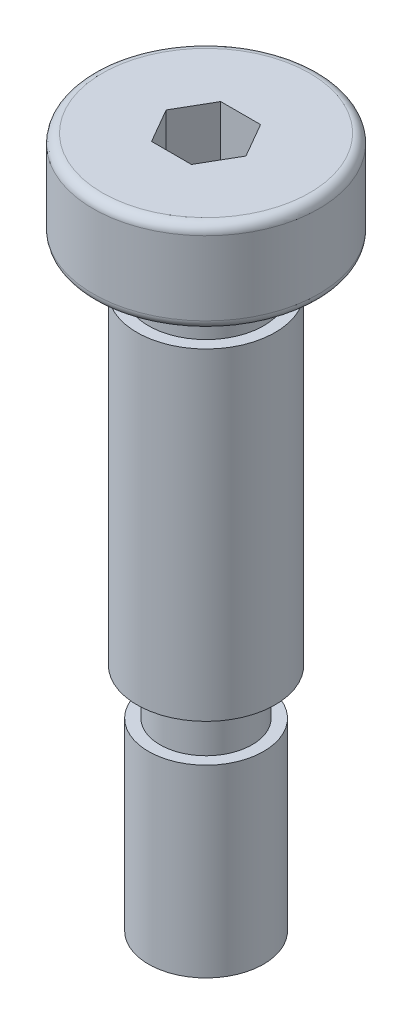
from build123d import *

# Parameters (mm, degrees)
CUT_EXTRUDE_1_DEPTH = 3.5


with BuildPart() as part:
    # 草图1 → 旋转1 (revolve)
    with BuildSketch(Plane.XY, mode=Mode.PRIVATE) as revolve_1_sk:
        with BuildLine():
            Line((0, 30), (-4.5, 30))
            ThreePointArc((-4.5, 30), (-4.782842712, 29.882842712), (-4.9, 29.6))
            Line((-4.9, 29.6), (-4.9, 26.4))
            ThreePointArc((-4.9, 26.4), (-4.782842712, 26.117157288), (-4.5, 26))
            Line((-4.5, 26), (-2.5, 26))
            Line((-2.5, 26), (-2.5, 24))
            Line((-2.5, 24), (-3, 24))
            Line((-3, 24), (-3, 10))
            Line((-3, 10), (-2, 10))
            Line((-2, 10), (-2, 8))
            Line((-2, 8), (-2.5, 8))
            Line((-2.5, 8), (-2.5, 0))
            Line((-2.5, 0), (0, 0))
            Line((0, 0), (0, 30))
        make_face()
    revolve(revolve_1_sk.sketch.rotate(Axis((0, 0, 0), (0, 1, 0)), 270), axis=Axis((0, 0, 0), (0, 1, 0)))

    # 草图2 → 切除-拉伸1 (cut)
    with BuildSketch(Plane(origin=(0, 30, 0), x_dir=(1, 0, 0), z_dir=(0, 1, 0))):
        Polygon((0.866025404, 1.5), (-0.866025404, 1.5), (-1.732050808, 0), (-0.866025404, -1.5), (0.866025404, -1.5), (1.732050808, 0), align=None)
    extrude(amount=-CUT_EXTRUDE_1_DEPTH, mode=Mode.SUBTRACT)


solid = part.part
